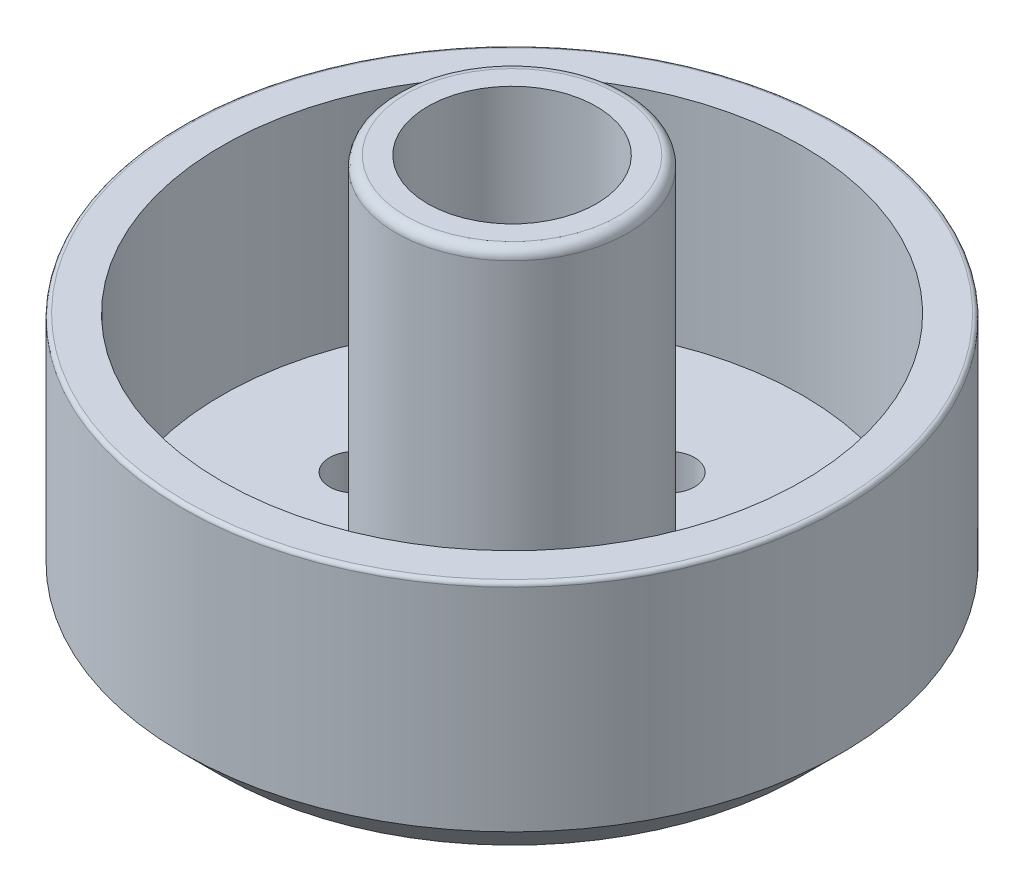
from build123d import *

# Parameters (mm, degrees)
SKETCH_1_R          = 16.8
SKETCH_1_R_2        = 1.3
SKETCH_1_R_3        = 4.3
EXTRUDE_1_DEPTH     = 13
SKETCH_2_R          = 14.8
CUT_EXTRUDE_1_DEPTH = 11
FILLET_1_R          = 0.2
SKETCH_3_R          = 5.9
SKETCH_3_R_2        = 4.3
EXTRUDE_2_DEPTH     = 18
FILLET_2_R          = 0.5


with BuildPart() as part:
    # 草图1 → 凸台-拉伸1 (new body)
    with BuildSketch(Plane(origin=(0, 0, 0), x_dir=(1, 0, 0), z_dir=(0, 1, 0))):
        with Locations(Location((0, 0, 0), (0, 0, 270))):
            Circle(SKETCH_1_R)
        with Locations(Location((0, 8, 0), (0, 0, 270))):
            Circle(SKETCH_1_R_2, mode=Mode.SUBTRACT)
        with Locations(Location((8, 0, 0), (0, 0, 270))):
            Circle(SKETCH_1_R_2, mode=Mode.SUBTRACT)
        with Locations(Location((0, -8, 0), (0, 0, 270))):
            Circle(SKETCH_1_R_2, mode=Mode.SUBTRACT)
        with Locations(Location((-8, 0, 0), (0, 0, 270))):
            Circle(SKETCH_1_R_2, mode=Mode.SUBTRACT)
        with Locations(Location((0, 0, 0), (0, 0, 270))):
            Circle(SKETCH_1_R_3, mode=Mode.SUBTRACT)
    extrude(amount=EXTRUDE_1_DEPTH)

    # 草图2 → 切除-拉伸1 (cut)
    with BuildSketch(Plane(origin=(0, 13, 0), x_dir=(1, 0, 0), z_dir=(0, 1, 0))):
        with Locations(Location((0, 0, 0), (0, 0, 270))):
            Circle(SKETCH_2_R)
    extrude(amount=-CUT_EXTRUDE_1_DEPTH, mode=Mode.SUBTRACT)

    # 圆角1
    fillet_1_edges = [part.edges().sort_by_distance(p)[0] for p in [
        (0, 13, -16.8),
    ]]
    fillet(fillet_1_edges, radius=FILLET_1_R)

    # 草图3 → 凸台-拉伸2 (add)
    with BuildSketch(Plane(origin=(0, 2, 0), x_dir=(1, 0, 0), z_dir=(0, 1, 0))):
        with Locations(Location((0, 0, 0), (0, 0, 270))):
            Circle(SKETCH_3_R)
        with Locations(Location((0, 0, 0), (0, 0, 270))):
            Circle(SKETCH_3_R_2, mode=Mode.SUBTRACT)
    extrude(amount=EXTRUDE_2_DEPTH)

    # 圆角2
    fillet_2_edges = [part.edges().sort_by_distance(p)[0] for p in [
        (0, 20, -5.9),
    ]]
    fillet(fillet_2_edges, radius=FILLET_2_R)

    # 草图4 → 切除-旋转1 (revolve, cut)
    with BuildSketch(Plane.XY, mode=Mode.PRIVATE) as cut_revolve_1_sk:
        Polygon((-16.8, 2), (-14.8, 0), (-16.8, 0), align=None)
    revolve(cut_revolve_1_sk.sketch.rotate(Axis((0, 23.77463501, 0), (0, -1, 0)), 270), axis=Axis((0, 23.77463501, 0), (0, -1, 0)), mode=Mode.SUBTRACT)


solid = part.part
